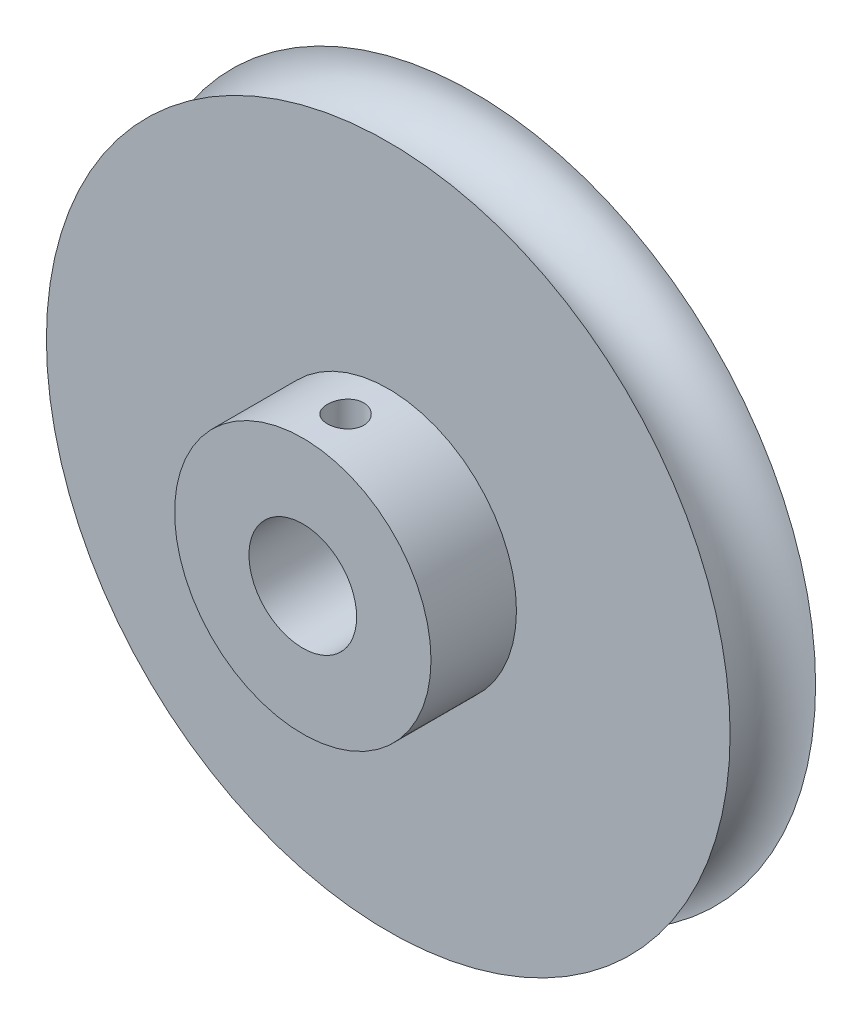
from build123d import *

# Parameters (mm, degrees)
SKETCH1_R                 = 25.4
BOSS_EXTRUDE1_DEPTH       = 6.35
SKETCH2_R                 = 9.525
BOSS_EXTRUDE2_DEPTH       = 6.35
SKETCH3_R                 = 4
CUT_EXTRUDE1_DEPTH        = 12.7
F_6_32_TAPPED_HOLE1_D     = 2.7051
F_6_32_TAPPED_HOLE1_DEPTH = 9.524
F_6_32_TAPPED_HOLE1_TIP   = 0.81269403


with BuildPart() as part:
    # Sketch1 → Boss-Extrude1 (new body)
    with BuildSketch(Plane.XY):
        Circle(SKETCH1_R)
    extrude(amount=BOSS_EXTRUDE1_DEPTH)

    # Sketch2 → Boss-Extrude2 (add)
    with BuildSketch(Plane.XY.offset(6.35)):
        Circle(SKETCH2_R)
    extrude(amount=BOSS_EXTRUDE2_DEPTH)

    # Sketch3 → Cut-Extrude1 (cut)
    with BuildSketch(Plane.XY.offset(12.7)):
        Circle(SKETCH3_R)
    extrude(amount=-CUT_EXTRUDE1_DEPTH, mode=Mode.SUBTRACT)

    # Sketch4 → Cut-Revolve1 (revolve, cut)
    with BuildSketch(Plane(origin=(0, 0, 0), x_dir=(1, 0, 0), z_dir=(0, 1, 0)), mode=Mode.PRIVATE) as cut_revolve1_sk:
        with BuildLine():
            Line((25.4, -6.35), (25.4, 0))
            ThreePointArc((25.4, 0), (22.225, -3.175), (25.4, -6.35))
        make_face()
    revolve(cut_revolve1_sk.sketch.rotate(Axis((0, 0, -6.424339231), (0, 0, 1)), 180), axis=Axis((0, 0, -6.424339231), (0, 0, 1)), mode=Mode.SUBTRACT)

    # #6-32 Tapped Hole1
    with Locations(Plane(origin=(0, 9.525, 9.525), x_dir=(1, 0, 0), z_dir=(0, 1, 0))):
        with Locations((0, 0)):
            Hole(F_6_32_TAPPED_HOLE1_D / 2, depth=F_6_32_TAPPED_HOLE1_DEPTH)
            with Locations((0, 0, -(F_6_32_TAPPED_HOLE1_DEPTH + F_6_32_TAPPED_HOLE1_TIP / 2))):  # 118° drill point
                Cone(0, F_6_32_TAPPED_HOLE1_D / 2, F_6_32_TAPPED_HOLE1_TIP, mode=Mode.SUBTRACT)


solid = part.part
